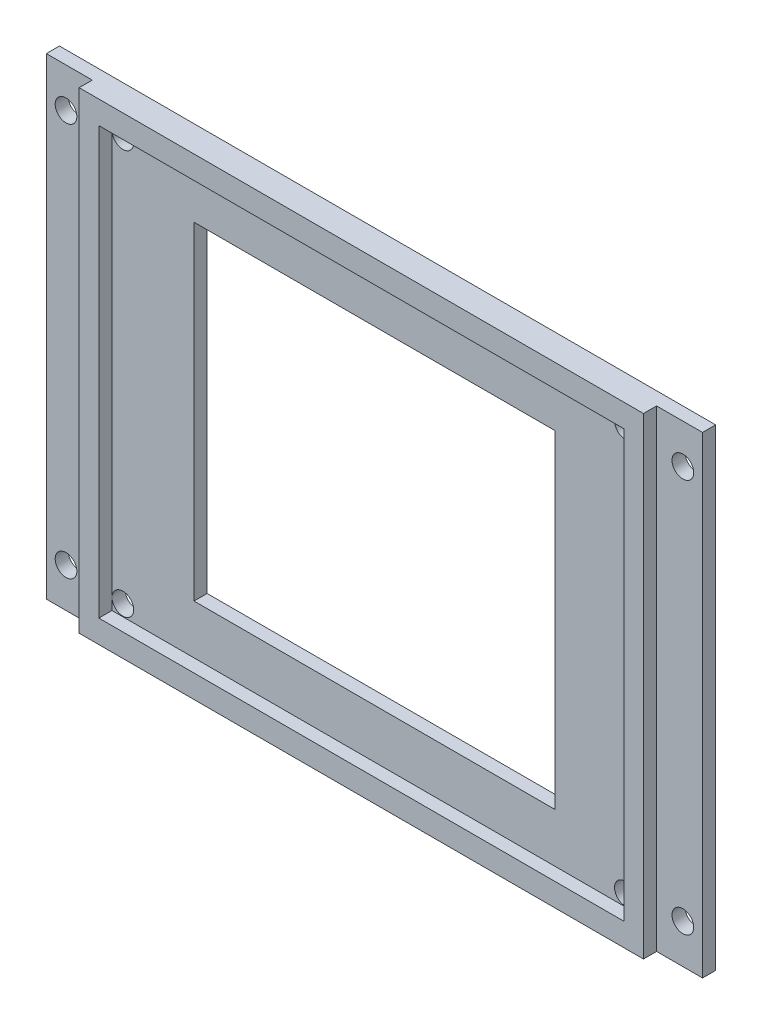
from build123d import *

# Parameters (mm, degrees)
SKETCH_1_W          = 100
SKETCH_1_H          = 72
EXTRUDE_1_DEPTH     = 4
SKETCH_2_W          = 80
SKETCH_2_H          = 65
CUT_EXTRUDE_1_DEPTH = 2
SKETCH_3_R          = 1.65
CUT_EXTRUDE_2_DEPTH = 2
SKETCH_4_R          = 1.65
CUT_EXTRUDE_3_DEPTH = 4
SKETCH_5_W          = 7
SKETCH_5_H          = 72
CUT_EXTRUDE_4_DEPTH = 2
SKETCH_6_W          = 55
SKETCH_6_H          = 50
CUT_EXTRUDE_5_DEPTH = 2


with BuildPart() as part:
    # 草图1 → 凸台-拉伸1 (new body)
    with BuildSketch(Plane.XY):
        Rectangle(SKETCH_1_W, SKETCH_1_H)
    extrude(amount=EXTRUDE_1_DEPTH)

    # 草图2 → 切除-拉伸1 (cut)
    with BuildSketch(Plane.XY.offset(4)):
        Rectangle(SKETCH_2_W, SKETCH_2_H)
    extrude(amount=-CUT_EXTRUDE_1_DEPTH, mode=Mode.SUBTRACT)

    # 草图3 → 切除-拉伸2 (cut)
    with BuildSketch(Plane.XY.offset(2)):
        with Locations((-38.340391641, 30.83641332)):
            Circle(SKETCH_3_R)
        with Locations((38.240608359, 30.83641332)):
            Circle(SKETCH_3_R)
        with Locations((38.240608359, -30.75858668)):
            Circle(SKETCH_3_R)
        with Locations((-38.340391641, -30.75858668)):
            Circle(SKETCH_3_R)
    extrude(amount=-CUT_EXTRUDE_2_DEPTH, mode=Mode.SUBTRACT)

    # 草图4 → 切除-拉伸3 (cut)
    with BuildSketch(Plane.XY.offset(4)):
        with Locations((-47, 30)):
            Circle(SKETCH_4_R)
        with Locations((47, 30)):
            Circle(SKETCH_4_R)
        with Locations((47, -30)):
            Circle(SKETCH_4_R)
        with Locations((-47, -30)):
            Circle(SKETCH_4_R)
    extrude(amount=-CUT_EXTRUDE_3_DEPTH, mode=Mode.SUBTRACT)

    # 草图5 → 切除-拉伸4 (cut)
    with BuildSketch(Plane.XY.offset(4)):
        with Locations((-46.5, 0)):
            Rectangle(SKETCH_5_W, SKETCH_5_H)
        with Locations((46.5, 0)):
            Rectangle(SKETCH_5_W, SKETCH_5_H)
    extrude(amount=-CUT_EXTRUDE_4_DEPTH, mode=Mode.SUBTRACT)

    # 草图6 → 切除-拉伸5 (cut)
    with BuildSketch(Plane.XY.offset(2)):
        Rectangle(SKETCH_6_W, SKETCH_6_H)
    extrude(amount=-CUT_EXTRUDE_5_DEPTH, mode=Mode.SUBTRACT)


solid = part.part
